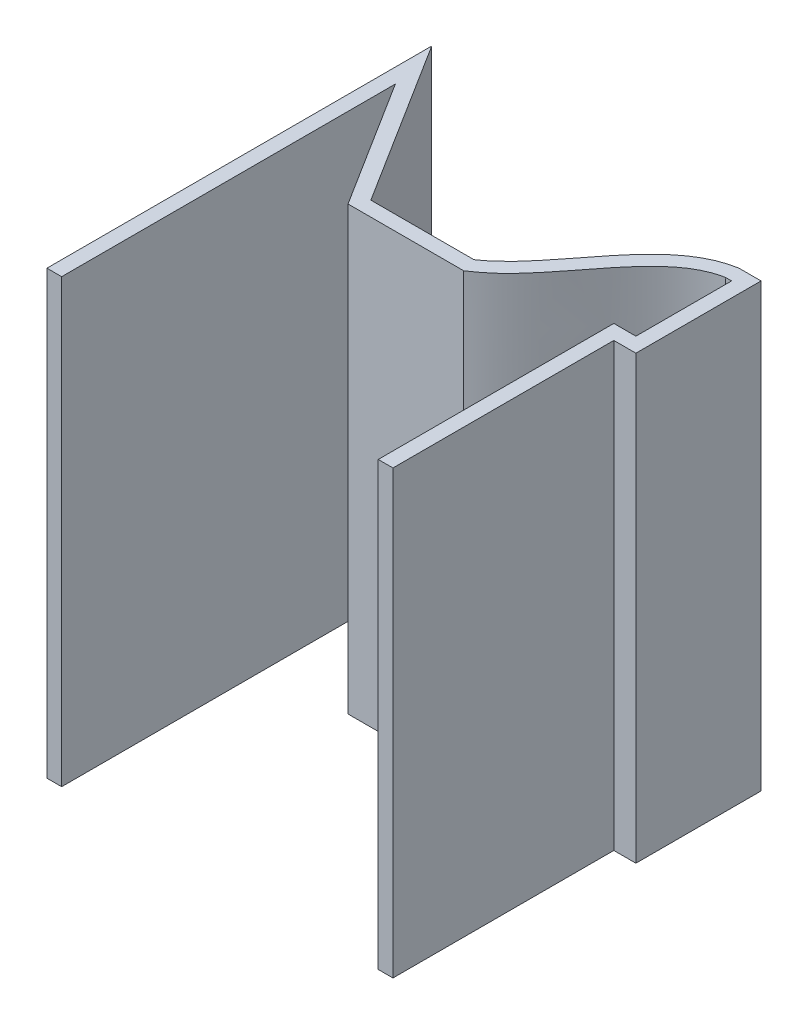
from build123d import *

# Parameters (mm, degrees)
BOSS_EXTRUDE12_DEPTH = 60
BOSS_EXTRUDE13_DEPTH = 8


with BuildPart() as part:
    # Sketch1 → Boss-Extrude12 (new body)
    with BuildSketch(Plane(origin=(0, 0, 0), x_dir=(1, 0, 0), z_dir=(0, 1, 0))):
        with BuildLine():
            Line((3, 47), (3, 30))
            Line((3, 30), (0, 30))
            Line((0, 30), (0, 0))
            Line((0, 0), (-2, 0))
            Line((-2, 0), (-2, 32))
            Line((-2, 32), (1, 32))
            Line((1, 32), (1, 45))
            Line((1, 45), (0.176102142, 45))
            add(Edge.make_bspline(
                [(-18.386432119, 28), (-18.281589374, 28.071011485), (-18.076006872, 28.210643772), (-17.632017964, 28.509033814), (-16.788752159, 29.127765228), (-15.266101597, 30.436706514), (-13.281769764, 32.578807621), (-11.116323446, 35.322397153), (-8.327983452, 38.971629637), (-4.796332276, 42.989291988), (-1.605396872, 44.667429051), (0.176102142, 45)],
                knots=[0.007315744, 0.007315744, 0.007315744, 0.007315744, 0.023228008, 0.039140272, 0.0709648, 0.134613856, 0.261911967, 0.389210078, 0.516508189, 0.771104411, 1.025700634, 1.025700634, 1.025700634, 1.025700634], degree=3))
            Line((-18.386432119, 28), (-34.105031298, 28))
            Line((-34.105031298, 28), (-45, 45.32952773))
            Line((-45, 45.32952773), (-45, 0))
            Line((-45, 0), (-47, 0))
            Line((-47, 0), (-47, 52.268387809))
            Line((-47, 52.268387809), (-33, 30))
            Line((-33, 30), (-19, 30))
            add(Edge.make_bspline(
                [(0, 47), (-8.735842334, 45.522262704), (-12.411198706, 34.462689008), (-19, 30)],
                knots=[0, 0, 0, 0, 1, 1, 1, 1], degree=3))
            Line((0, 47), (3, 47))
        make_face()
    extrude(amount=BOSS_EXTRUDE12_DEPTH)

    # Sketch2 → Boss-Extrude13 (add)
    with BuildSketch(Plane(origin=(0, 0, -30), x_dir=(-1, 0, 0), z_dir=(0, 0, -1))):
        with BuildLine():
            Line((33, 0), (19, 0))
            Line((19, 0), (19, 2.423963318))
            ThreePointArc((19, 2.423963318), (26, 2), (33, 2.423963318))
            Line((33, 2.423963318), (33, 0))
        make_face()
    extrude(amount=BOSS_EXTRUDE13_DEPTH)


solid = part.part
